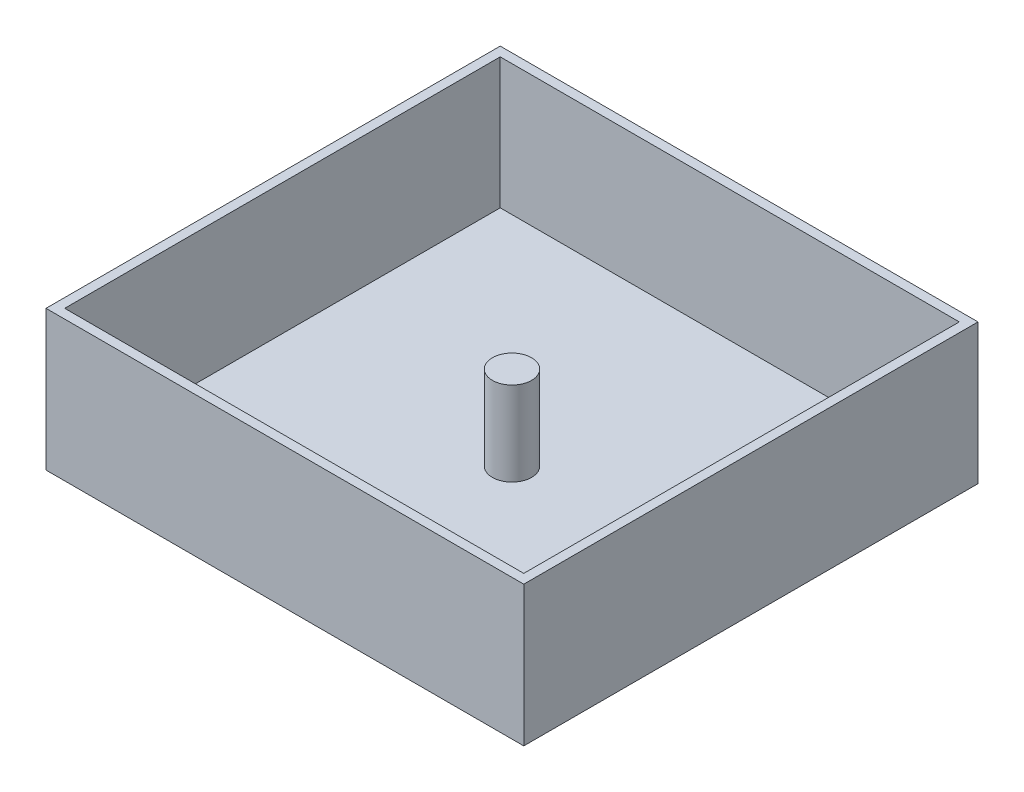
from build123d import *

# Parameters (mm, degrees)
SKETCH1_W           = 511.53
SKETCH1_H           = 486.32
BOSS_EXTRUDE1_DEPTH = 150
SHELL1_T            = -10
SKETCH2_R           = 21
BOSS_EXTRUDE2_DEPTH = 90
SCALE1_SCALE        = 0.1
SCALE2_SCALE        = 3


with BuildPart() as part:
    # Sketch1 → Boss-Extrude1 (new body)
    with BuildSketch(Plane(origin=(0, 0, 0), x_dir=(1, 0, 0), z_dir=(0, 1, 0))):
        Rectangle(SKETCH1_W, SKETCH1_H)
    extrude(amount=BOSS_EXTRUDE1_DEPTH)

    # Shell1
    shell1_openings = [part.faces().sort_by_distance(p)[0] for p in [
        (0, 150, 0),
    ]]
    offset(amount=SHELL1_T, openings=shell1_openings, kind=Kind.INTERSECTION)

    # Sketch2 → Boss-Extrude2 (add)
    with BuildSketch(Plane(origin=(0, 10, 0), x_dir=(1, 0, 0), z_dir=(0, 1, 0))):
        with Locations(Location((0, 0, 0), (0, 0, 90))):
            Circle(SKETCH2_R)
    extrude(amount=BOSS_EXTRUDE2_DEPTH)


with BuildPart() as part_1:
    # Scale1: scaled about (0, 0, 0)
    add(part.part.scale(SCALE1_SCALE))


with BuildPart() as part_2:
    # Scale2: scaled about (0, 0, 0)
    add(part_1.part.scale(SCALE2_SCALE))


solid = part_2.part
